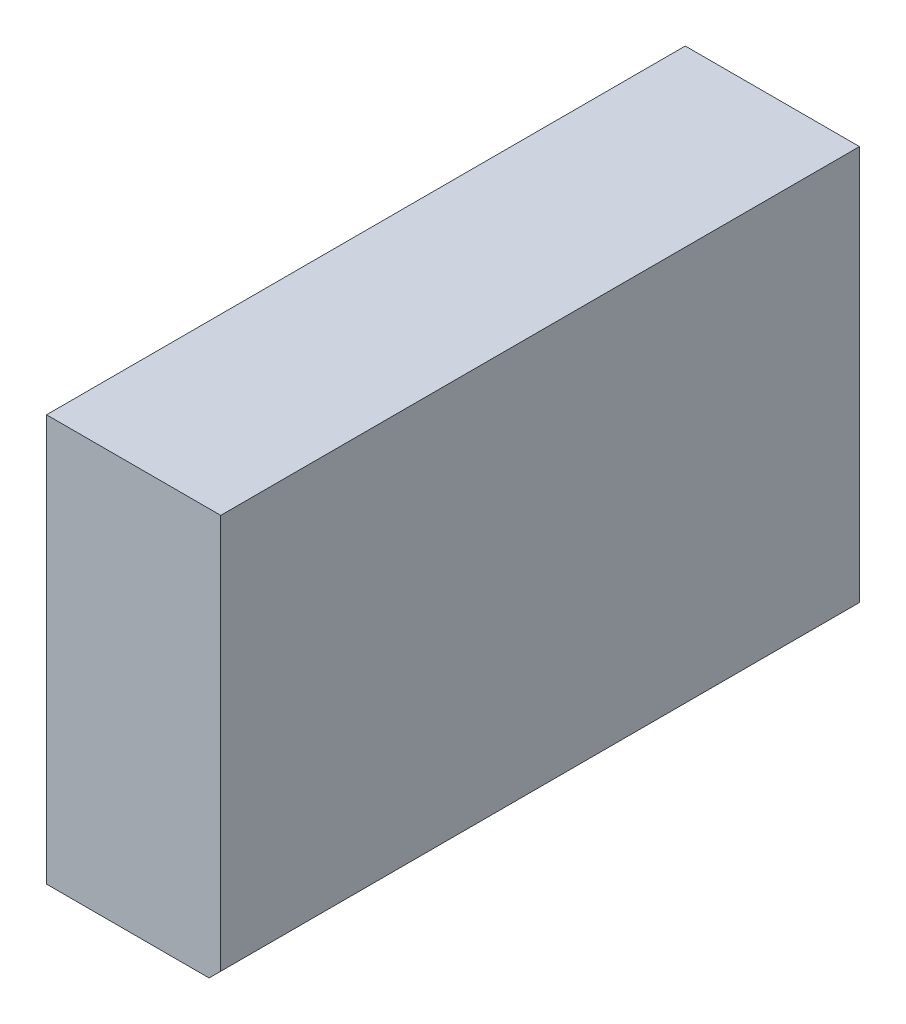
from build123d import *

# Parameters (mm, degrees)
SKETCH1_W           = 38.1
SKETCH1_H           = 88.9
BOSS_EXTRUDE1_DEPTH = 139.7
CHAMFER1_SIZE       = 2.54


with BuildPart() as part:
    # Sketch1 → Boss-Extrude1 (new body)
    with BuildSketch(Plane.XY):
        with Locations((19.05, 44.45)):
            Rectangle(SKETCH1_W, SKETCH1_H)
    extrude(amount=BOSS_EXTRUDE1_DEPTH)

    # Chamfer1
    chamfer1_edges = [part.edges().sort_by_distance(p)[0] for p in [
        (38.1, 0, 69.85),
    ]]
    chamfer(chamfer1_edges, length=CHAMFER1_SIZE)


solid = part.part
